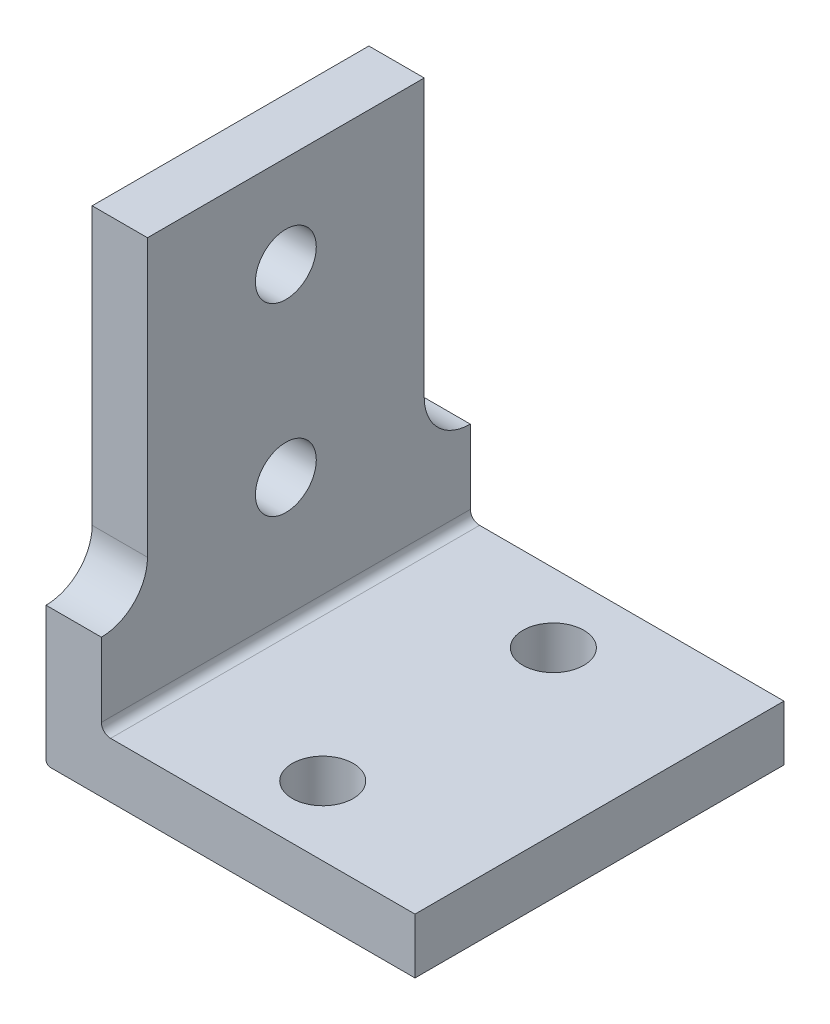
from build123d import *

# Parameters (mm, degrees)
BOSS_EXTRUDE1_DEPTH  = 40
M6_CLEARANCE_HOLE1_D = 6.6
M6_CLEARANCE_HOLE2_D = 6.6
FILLET1_R            = 1
FILLET2_R            = 0.5
CUT_EXTRUDE1_DEPTH   = 73.498275842


with BuildPart() as part:
    # Sketch1 → Boss-Extrude1 (new body)
    with BuildSketch(Plane.XY):
        Polygon((0, 0), (40, 0), (40, 6), (6, 6), (6, 50), (0, 50), align=None)
    extrude(amount=BOSS_EXTRUDE1_DEPTH)

    # M6 Clearance Hole1 (through all)
    with Locations(Plane(origin=(6, 0, 0), x_dir=(0, 0, -1), z_dir=(1, 0, 0))):
        with Locations((-20, 40), (-20, 20)):
            Hole(M6_CLEARANCE_HOLE1_D / 2)

    # M6 Clearance Hole2 (through all)
    with Locations(Plane(origin=(0, 0, 0), x_dir=(-1, 0, 0), z_dir=(0, -1, 0))):
        with Locations((-22.5, -32.5), (-22.5, -7.5)):
            Hole(M6_CLEARANCE_HOLE2_D / 2)

    # Fillet1
    fillet1_edges = [part.edges().sort_by_distance(p)[0] for p in [
        (6, 6, 20),
    ]]
    fillet(fillet1_edges, radius=FILLET1_R)

    # Fillet2
    fillet2_edges = [part.edges().sort_by_distance(p)[0] for p in [
        (0, 0, 20),
    ]]
    fillet(fillet2_edges, radius=FILLET2_R)

    # Sketch7 → Cut-Extrude1 (cut, through all)
    with BuildSketch(Plane(origin=(6, 0, 0), x_dir=(0, 0, -1), z_dir=(1, 0, 0))):
        with BuildLine():
            Line((-5, 50), (0, 50))
            Line((0, 50), (0, 15))
            ThreePointArc((0, 15), (-3.535533906, 16.464466094), (-5, 20))
            Line((-5, 20), (-5, 50))
        make_face()
        with BuildLine():
            Line((-35, 20), (-35, 50))
            Line((-35, 50), (-40, 50))
            Line((-40, 50), (-40, 15))
            ThreePointArc((-40, 15), (-36.464466094, 16.464466094), (-35, 20))
        make_face()
    extrude(amount=-CUT_EXTRUDE1_DEPTH, mode=Mode.SUBTRACT)


solid = part.part
